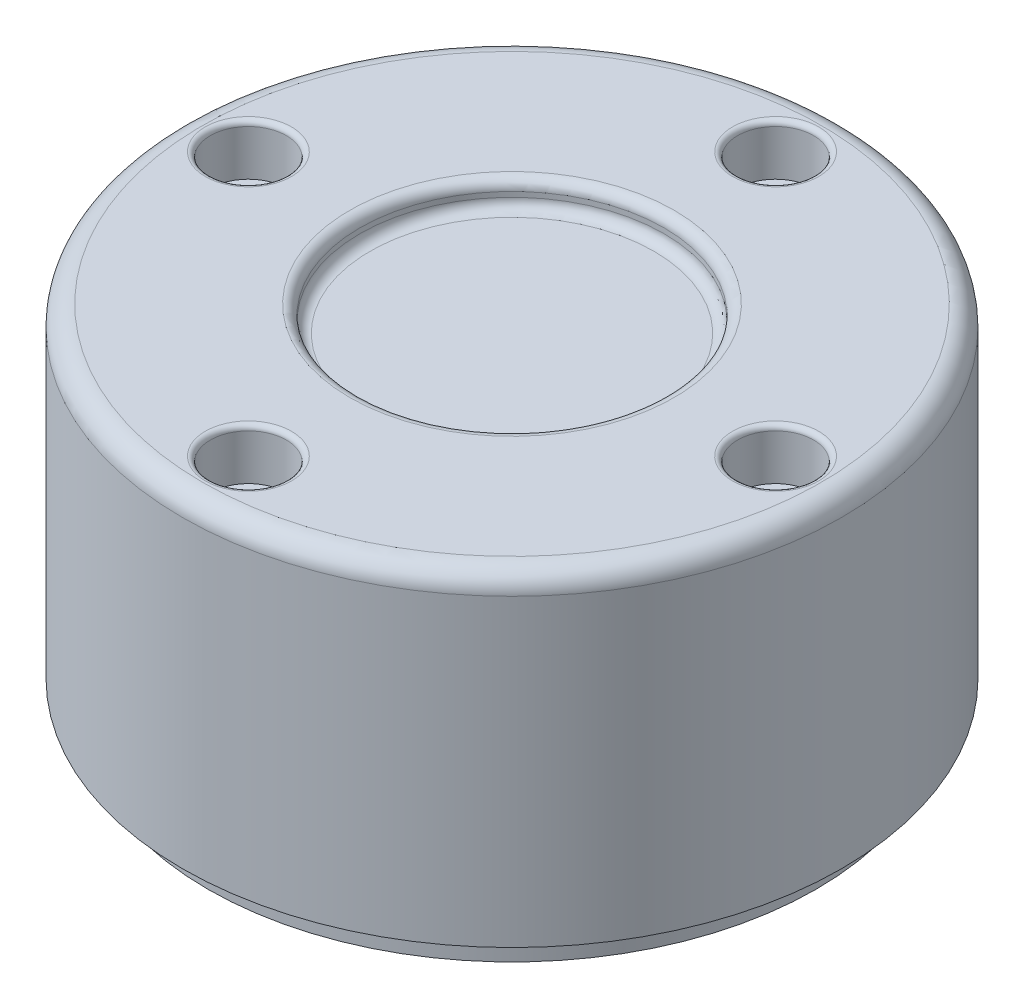
from build123d import *

# Parameters (mm, degrees)
SKETCH2_R           = 30
BOSS_EXTRUDE1_DEPTH = 3
SKETCH3_R           = 32.5
BOSS_EXTRUDE2_DEPTH = 32
SKETCH4_R           = 15
CUT_EXTRUDE1_DEPTH  = 2.5
SKETCH4_3_R         = 3.75
CUT_EXTRUDE2_DEPTH  = 5
FILLET1_R           = 1
FILLET2_R           = 1
FILLET3_R           = 2
FILLET4_R           = 0.5


with BuildPart() as part:
    # Sketch2 → Boss-Extrude1 (new body)
    with BuildSketch(Plane(origin=(0, 0, 0), x_dir=(1, 0, 0), z_dir=(0, 1, 0))):
        Circle(SKETCH2_R)
    extrude(amount=BOSS_EXTRUDE1_DEPTH)

    # Sketch3 → Boss-Extrude2 (add)
    with BuildSketch(Plane(origin=(0, 3, 0), x_dir=(1, 0, 0), z_dir=(0, 1, 0))):
        Circle(SKETCH3_R)
    extrude(amount=BOSS_EXTRUDE2_DEPTH)

    # Sketch4 → Cut-Extrude1 (cut)
    with BuildSketch(Plane(origin=(0, 35, 0), x_dir=(1, 0, 0), z_dir=(0, 1, 0))):
        Circle(SKETCH4_R)
    extrude(amount=-CUT_EXTRUDE1_DEPTH, mode=Mode.SUBTRACT)

    # Sketch4<3> → Cut-Extrude2 (cut)
    with BuildSketch(Plane(origin=(0, 35, 0), x_dir=(1, 0, 0), z_dir=(0, 1, 0))):
        with Locations((0, 26)):
            Circle(SKETCH4_3_R)
        with Locations((26, 0)):
            Circle(SKETCH4_3_R)
        with Locations((0, -26)):
            Circle(SKETCH4_3_R)
        with Locations((-26, 0)):
            Circle(SKETCH4_3_R)
    extrude(amount=-CUT_EXTRUDE2_DEPTH, mode=Mode.SUBTRACT)

    # Fillet1
    fillet1_edges = [part.edges().sort_by_distance(p)[0] for p in [
        (-15, 32.5, 0),
    ]]
    fillet(fillet1_edges, radius=FILLET1_R)

    # Fillet2
    fillet2_edges = [part.edges().sort_by_distance(p)[0] for p in [
        (-15, 35, 0),
    ]]
    fillet(fillet2_edges, radius=FILLET2_R)

    # Fillet3
    fillet3_edges = [part.edges().sort_by_distance(p)[0] for p in [
        (-32.5, 35, 0),
    ]]
    fillet(fillet3_edges, radius=FILLET3_R)

    # Fillet4
    fillet4_edges = [part.edges().sort_by_distance(p)[0] for p in [
        (-3.75, 35, 26),
        (22.25, 35, 0),
        (-3.75, 35, -26),
        (-29.75, 35, 0),
    ]]
    fillet(fillet4_edges, radius=FILLET4_R)


solid = part.part
